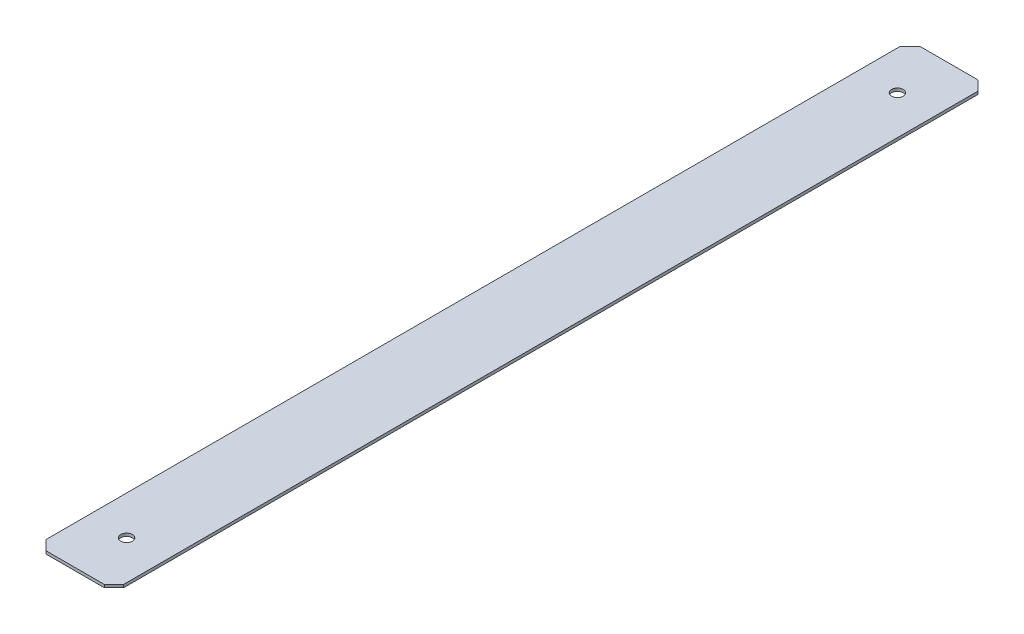
from build123d import *

# Parameters (mm, degrees)
SKETCH1_W           = 40
SKETCH1_H           = 450
BOSS_EXTRUDE1_DEPTH = 1.5
CHAMFER1_SIZE       = 5
SKETCH2_R           = 3
CUT_EXTRUDE1_DEPTH  = 226.89212027


with BuildPart() as part:
    # Sketch1 → Boss-Extrude1 (new body)
    with BuildSketch(Plane(origin=(0, 0, 0), x_dir=(1, 0, 0), z_dir=(0, 1, 0))):
        Rectangle(SKETCH1_W, SKETCH1_H)
    extrude(amount=BOSS_EXTRUDE1_DEPTH)

    # Chamfer1
    chamfer1_edges = [part.edges().sort_by_distance(p)[0] for p in [
        (20, 0.75, 225),
        (-20, 0.75, 225),
        (-20, 0.75, -225),
        (20, 0.75, -225),
    ]]
    chamfer(chamfer1_edges, length=CHAMFER1_SIZE)

    # Sketch2 → Cut-Extrude1 (cut, through all)
    with BuildSketch(Plane(origin=(0, 1.5, 0), x_dir=(1, 0, 0), z_dir=(0, 1, 0))):
        with Locations(Location((0, 198.5, 0), (0, 0, 270))):
            Circle(SKETCH2_R)
        with Locations(Location((0, -198.5, 0), (0, 0, 90))):
            Circle(SKETCH2_R)
    extrude(amount=-CUT_EXTRUDE1_DEPTH, mode=Mode.SUBTRACT)


solid = part.part
